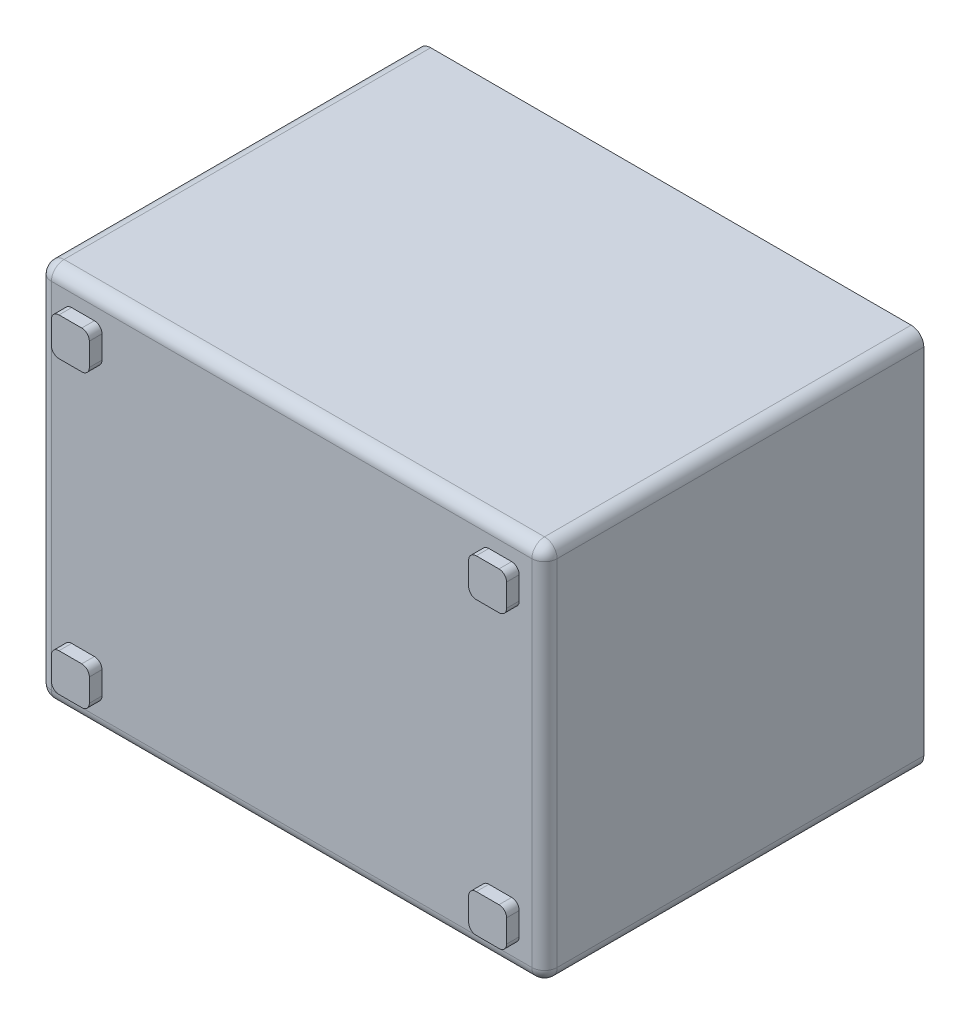
from build123d import *

# Parameters (mm, degrees)
SKETCH1_W           = 200
SKETCH1_H           = 150
BOSS_EXTRUDE1_DEPTH = 150
SKETCH2_W           = 190
SKETCH2_H           = 140
CUT_EXTRUDE1_DEPTH  = 145
SKETCH3_W           = 15
SKETCH3_H           = 15
BOSS_EXTRUDE3_DEPTH = 5
FILLET1_R           = 5
FILLET2_R           = 3


with BuildPart() as part:
    # Sketch1 → Boss-Extrude1 (new body)
    with BuildSketch(Plane.XY):
        with Locations((32.244318182, -44.957386364)):
            Rectangle(SKETCH1_W, SKETCH1_H)
    extrude(amount=BOSS_EXTRUDE1_DEPTH)

    # Sketch2 → Cut-Extrude1 (cut)
    with BuildSketch(Plane.XY):
        with Locations((32.244318182, -44.957386364)):
            Rectangle(SKETCH2_W, SKETCH2_H)
    extrude(amount=CUT_EXTRUDE1_DEPTH, mode=Mode.SUBTRACT)

    # Sketch3 → Boss-Extrude3 (add)
    with BuildSketch(Plane.XY.offset(150)):
        with Locations((-50.255681818, 12.542613636)):
            Rectangle(SKETCH3_W, SKETCH3_H)
        with Locations((114.744318182, 12.542613636)):
            Rectangle(SKETCH3_W, SKETCH3_H)
        with Locations((-50.255681818, -102.457386364)):
            Rectangle(SKETCH3_W, SKETCH3_H)
        with Locations((114.744318182, -102.457386364)):
            Rectangle(SKETCH3_W, SKETCH3_H)
    extrude(amount=BOSS_EXTRUDE3_DEPTH)

    # Fillet1
    fillet1_edges = [part.edges().sort_by_distance(p)[0] for p in [
        (132.244318182, -44.957386364, 150),
        (32.244318182, 30.042613636, 150),
        (-67.755681818, -44.957386364, 150),
        (-67.755681818, 30.042613636, 75),
        (132.244318182, 30.042613636, 75),
        (132.244318182, -119.957386364, 75),
        (-67.755681818, -119.957386364, 75),
        (32.244318182, -119.957386364, 150),
    ]]
    fillet(fillet1_edges, radius=FILLET1_R)

    # Fillet2
    fillet2_edges = [part.edges().sort_by_distance(p)[0] for p in [
        (-42.755681818, 5.042613636, 152.5),
        (-42.755681818, 20.042613636, 152.5),
        (-57.755681818, 20.042613636, 152.5),
        (-57.755681818, 5.042613636, 152.5),
        (122.244318182, 20.042613636, 152.5),
        (107.244318182, 20.042613636, 152.5),
        (107.244318182, 5.042613636, 152.5),
        (122.244318182, 5.042613636, 152.5),
        (-57.755681818, -94.957386364, 152.5),
        (-57.755681818, -109.957386364, 152.5),
        (-42.755681818, -109.957386364, 152.5),
        (-42.755681818, -94.957386364, 152.5),
        (122.244318182, -109.957386364, 152.5),
        (122.244318182, -94.957386364, 152.5),
        (107.244318182, -94.957386364, 152.5),
        (107.244318182, -109.957386364, 152.5),
    ]]
    fillet(fillet2_edges, radius=FILLET2_R)


solid = part.part
